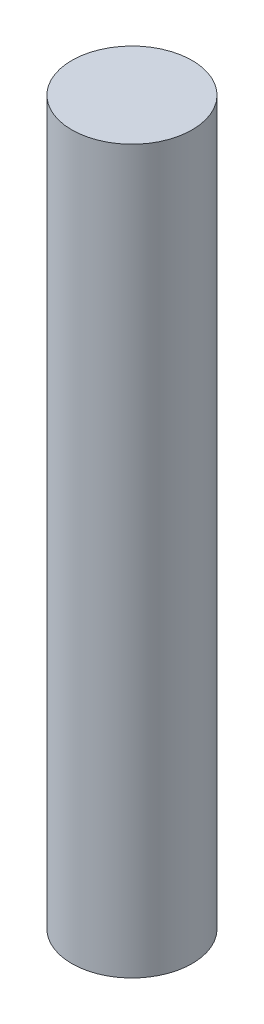
from build123d import *

# Parameters (mm, degrees)
SKETCH1_R           = 0.1875
BOSS_EXTRUDE1_DEPTH = 2.25


with BuildPart() as part:
    # Sketch1 → Boss-Extrude1 (new body)
    with BuildSketch(Plane(origin=(0, 0, 0), x_dir=(1, 0, 0), z_dir=(0, 1, 0))):
        with Locations(Location((0, 0, 0), (0, 0, 270))):
            Circle(SKETCH1_R)
    extrude(amount=BOSS_EXTRUDE1_DEPTH)


solid = part.part
